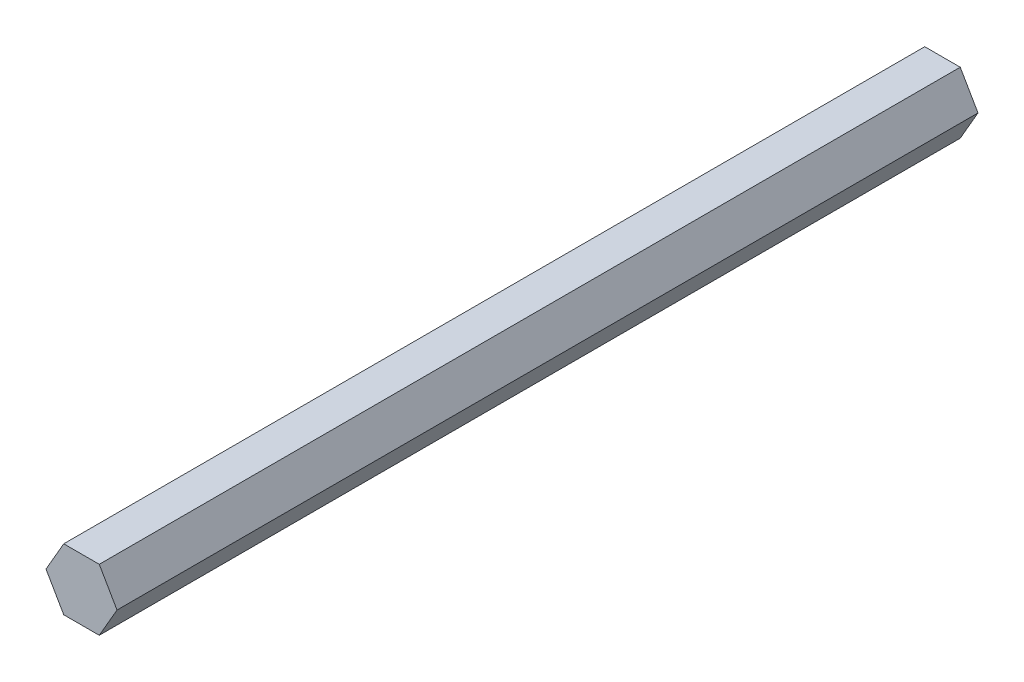
from build123d import *

# Parameters (mm, degrees)
BOSS_EXTRUDE1_DEPTH = 88.9


with BuildPart() as part:
    # Sketch1 → Boss-Extrude1 (new, symmetric)
    with BuildSketch(Plane.XY):
        Polygon((3.666174209, 6.35), (-3.666174209, 6.35), (-7.332348419, 0), (-3.666174209, -6.35), (3.666174209, -6.35), (7.332348419, 0), align=None)
    extrude(amount=BOSS_EXTRUDE1_DEPTH, both=True)


solid = part.part
